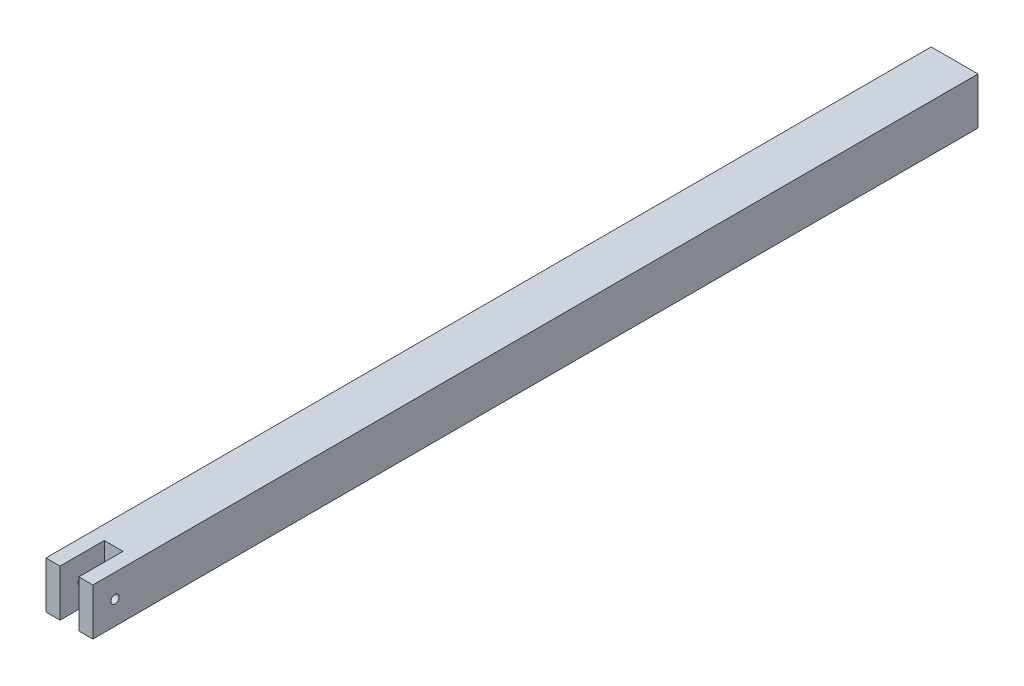
from build123d import *

# Parameters (mm, degrees)
ESQUISSE1_W             = 90
ESQUISSE1_H             = 90
BOSS_EXTRU_1_DEPTH      = 1700
ESQUISSE2_W             = 36
ESQUISSE2_H             = 85
ENL_V_MAT_EXTRU_1_DEPTH = 1705.758047349
ESQUISSE3_R             = 8
ENL_V_MAT_EXTRU_2_DEPTH = 1705.758047349


with BuildPart() as part:
    # Esquisse1 → Boss.-Extru.1 (new body)
    with BuildSketch(Plane.XY):
        with Locations((45, 45)):
            Rectangle(ESQUISSE1_W, ESQUISSE1_H)
    extrude(amount=BOSS_EXTRU_1_DEPTH)

    # Esquisse2 → Enlèv. mat.-Extru.1 (cut, through all)
    with BuildSketch(Plane.XZ):
        with Locations((45, 1657.5)):
            Rectangle(ESQUISSE2_W, ESQUISSE2_H)
    extrude(amount=-ENL_V_MAT_EXTRU_1_DEPTH, mode=Mode.SUBTRACT)

    # Esquisse3 → Enlèv. mat.-Extru.2 (cut, through all)
    with BuildSketch(Plane(origin=(90, 0, 0), x_dir=(0, 0, -1), z_dir=(1, 0, 0))):
        with Locations((-1657.5, 45)):
            Circle(ESQUISSE3_R)
    extrude(amount=-ENL_V_MAT_EXTRU_2_DEPTH, mode=Mode.SUBTRACT)


solid = part.part
